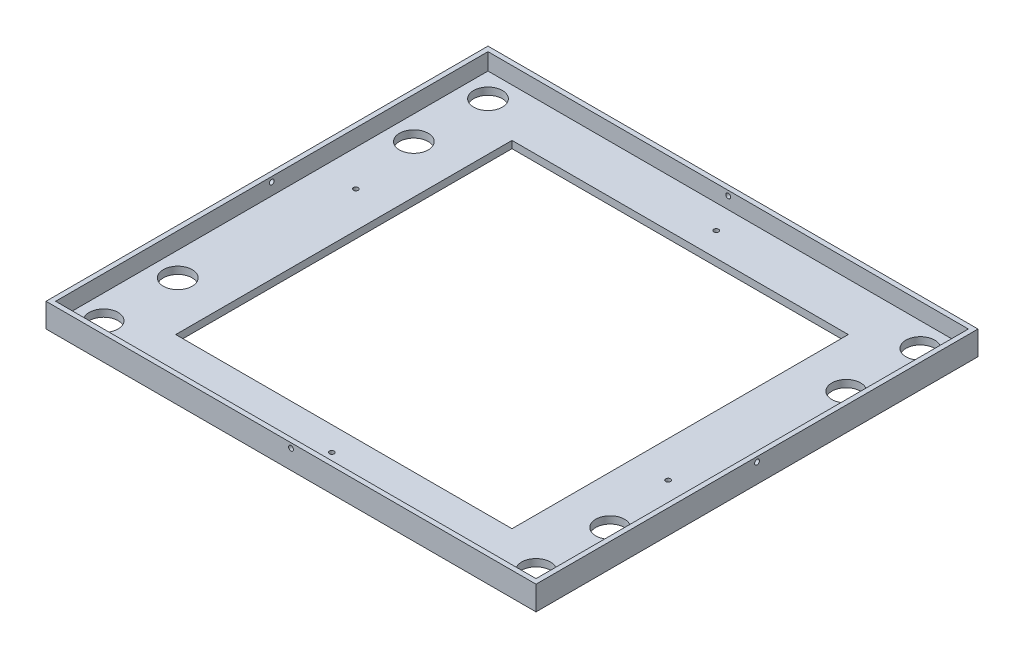
from build123d import *

# Parameters (mm, degrees)
SKETCH1_W           = 200
SKETCH1_H           = 180
SKETCH1_R           = 6
SKETCH1_R_2         = 1
SKETCH1_W_2         = 140
SKETCH1_H_2         = 140
BOSS_EXTRUDE4_DEPTH = 3
SKETCH1_3_W         = 204
SKETCH1_3_H         = 184
SKETCH1_3_W_2       = 200
SKETCH1_3_H_2       = 180
BOSS_EXTRUDE5_DEPTH = 10
SKETCH4_R           = 1
CUT_EXTRUDE1_DEPTH  = 2
SKETCH7_R           = 1
CUT_EXTRUDE2_DEPTH  = 2
CUT_EXTRUDE3_START  = -2
SKETCH6_R           = 1
CUT_EXTRUDE3_DEPTH  = 2
CUT_EXTRUDE4_START  = -2
SKETCH5_R           = 1
CUT_EXTRUDE4_DEPTH  = 2


with BuildPart() as part:
    # Sketch1 → Boss-Extrude4 (new body)
    with BuildSketch(Plane(origin=(0, 0, 0), x_dir=(1, 0, 0), z_dir=(0, 1, 0))):
        Rectangle(SKETCH1_W, SKETCH1_H)
        with Locations((-90, -80)):
            Circle(SKETCH1_R, mode=Mode.SUBTRACT)
        with Locations((-90, -49.146026748)):
            Circle(SKETCH1_R, mode=Mode.SUBTRACT)
        with Locations((5, -80)):
            Circle(SKETCH1_R_2, mode=Mode.SUBTRACT)
        with Locations((90, -80)):
            Circle(SKETCH1_R, mode=Mode.SUBTRACT)
        with Locations((90, -49.146026748)):
            Circle(SKETCH1_R, mode=Mode.SUBTRACT)
        with Locations((85, -20)):
            Circle(SKETCH1_R_2, mode=Mode.SUBTRACT)
        with Locations((-85, 20)):
            Circle(SKETCH1_R_2, mode=Mode.SUBTRACT)
        Rectangle(SKETCH1_W_2, SKETCH1_H_2, mode=Mode.SUBTRACT)
        with Locations((-90, 49.146026748)):
            Circle(SKETCH1_R, mode=Mode.SUBTRACT)
        with Locations((-90, 80)):
            Circle(SKETCH1_R, mode=Mode.SUBTRACT)
        with Locations((5, 80)):
            Circle(SKETCH1_R_2, mode=Mode.SUBTRACT)
        with Locations((90, 49.146026748)):
            Circle(SKETCH1_R, mode=Mode.SUBTRACT)
        with Locations((90, 80)):
            Circle(SKETCH1_R, mode=Mode.SUBTRACT)
    extrude(amount=BOSS_EXTRUDE4_DEPTH)

    # Sketch1<3> → Boss-Extrude5 (add)
    with BuildSketch(Plane(origin=(0, 0, 0), x_dir=(1, 0, 0), z_dir=(0, 1, 0))):
        Rectangle(SKETCH1_3_W, SKETCH1_3_H)
        Rectangle(SKETCH1_3_W_2, SKETCH1_3_H_2, mode=Mode.SUBTRACT)
    extrude(amount=BOSS_EXTRUDE5_DEPTH)

    # Sketch4 → Cut-Extrude1 (cut)
    with BuildSketch(Plane.ZY.offset(102)):
        with Locations((0, 8)):
            Circle(SKETCH4_R)
    extrude(amount=-CUT_EXTRUDE1_DEPTH, mode=Mode.SUBTRACT)

    # Sketch7 → Cut-Extrude2 (cut)
    with BuildSketch(Plane(origin=(0, 0, -92), x_dir=(-1, 0, 0), z_dir=(0, 0, -1))):
        with Locations((0, 8)):
            Circle(SKETCH7_R)
    extrude(amount=-CUT_EXTRUDE2_DEPTH, mode=Mode.SUBTRACT)

    # Sketch6 → Cut-Extrude3 (cut)
    with BuildSketch(Plane(origin=(102, 0, 0), x_dir=(0, 0, -1), z_dir=(1, 0, 0)).offset(CUT_EXTRUDE3_START)):
        with Locations((0, 8)):
            Circle(SKETCH6_R)
    extrude(amount=CUT_EXTRUDE3_DEPTH, mode=Mode.SUBTRACT)

    # Sketch5 → Cut-Extrude4 (cut)
    with BuildSketch(Plane.XY.offset(92).offset(CUT_EXTRUDE4_START)):
        with Locations((0, 8)):
            Circle(SKETCH5_R)
    extrude(amount=CUT_EXTRUDE4_DEPTH, mode=Mode.SUBTRACT)


solid = part.part
